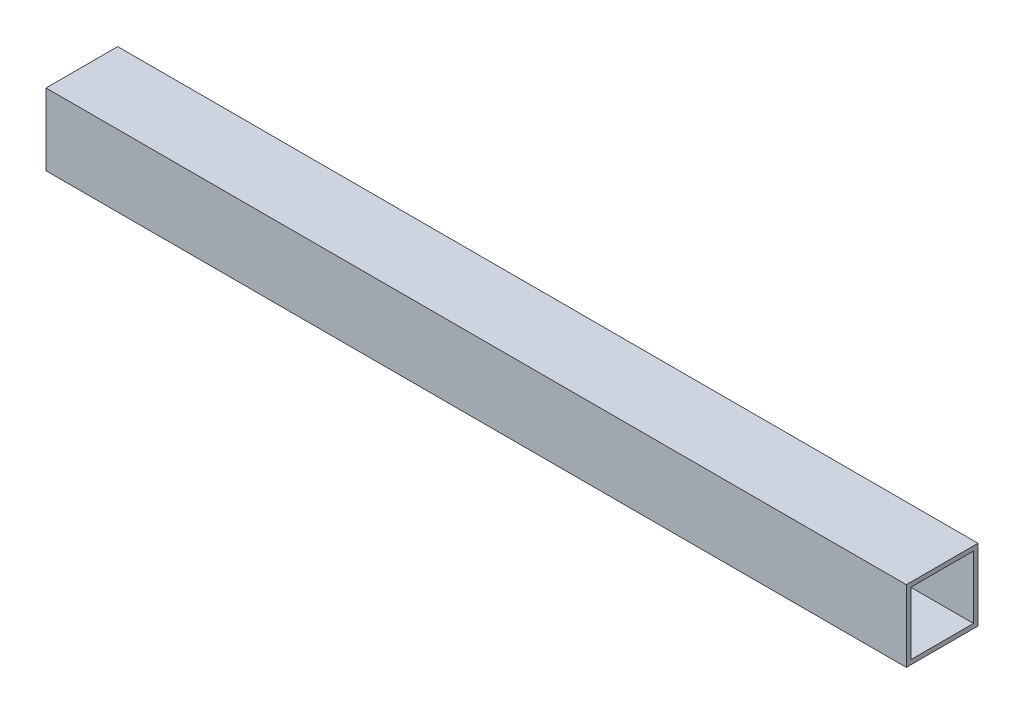
from build123d import *

# Parameters (mm, degrees)
SKETCH1_W           = 25.4
SKETCH1_H           = 25.4
BOSS_EXTRUDE1_DEPTH = 304.8
SKETCH2_W           = 22.225
SKETCH2_H           = 22.225
CUT_EXTRUDE1_DEPTH  = 306.896915292


with BuildPart() as part:
    # Sketch1 → Boss-Extrude1 (new body)
    with BuildSketch(Plane(origin=(0, 0, 0), x_dir=(0, 0, -1), z_dir=(1, 0, 0))):
        with Locations((-3.415258133, 7.552931652)):
            Rectangle(SKETCH1_W, SKETCH1_H)
    extrude(amount=BOSS_EXTRUDE1_DEPTH)

    # Sketch2 → Cut-Extrude1 (cut, through all)
    with BuildSketch(Plane.ZY):
        with Locations((3.415258133, 7.552931652)):
            Rectangle(SKETCH2_W, SKETCH2_H)
    extrude(amount=-CUT_EXTRUDE1_DEPTH, mode=Mode.SUBTRACT)


solid = part.part
